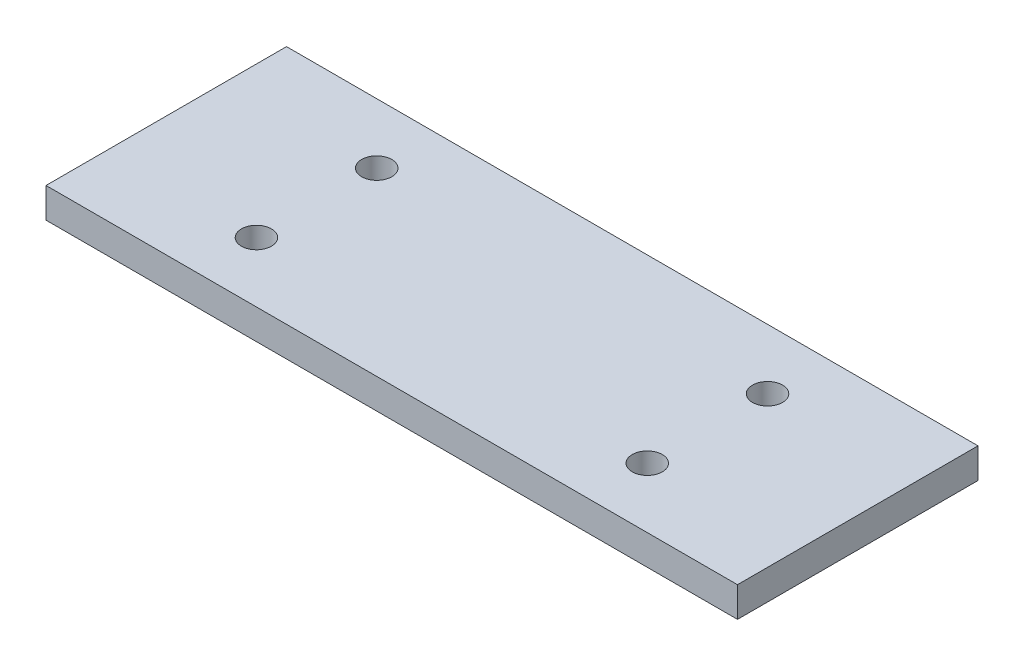
from build123d import *

# Parameters (mm, degrees)
SKETCH1_W           = 115
SKETCH1_H           = 40
BOSS_EXTRUDE1_DEPTH = 2.5
HOLE1_D             = 5


with BuildPart() as part:
    # Sketch1 → Boss-Extrude1 (new, symmetric)
    with BuildSketch(Plane(origin=(0, 0, 0), x_dir=(1, 0, 0), z_dir=(0, 1, 0))):
        Rectangle(SKETCH1_W, SKETCH1_H)
    extrude(amount=BOSS_EXTRUDE1_DEPTH, both=True)

    # Hole1 (through all)
    with Locations(Plane(origin=(0, 2.5, 0), x_dir=(1, 0, 0), z_dir=(0, 1, 0))):
        with Locations((32.5, 10), (32.5, -10)):
            hole1 = Hole(HOLE1_D / 2)

    # Mirror1: Hole1 across plane
    add(hole1.mirror(Plane(origin=(0, 0, 0), x_dir=(0, 0, 1), z_dir=(1, 0, 0))), mode=Mode.SUBTRACT)


solid = part.part
